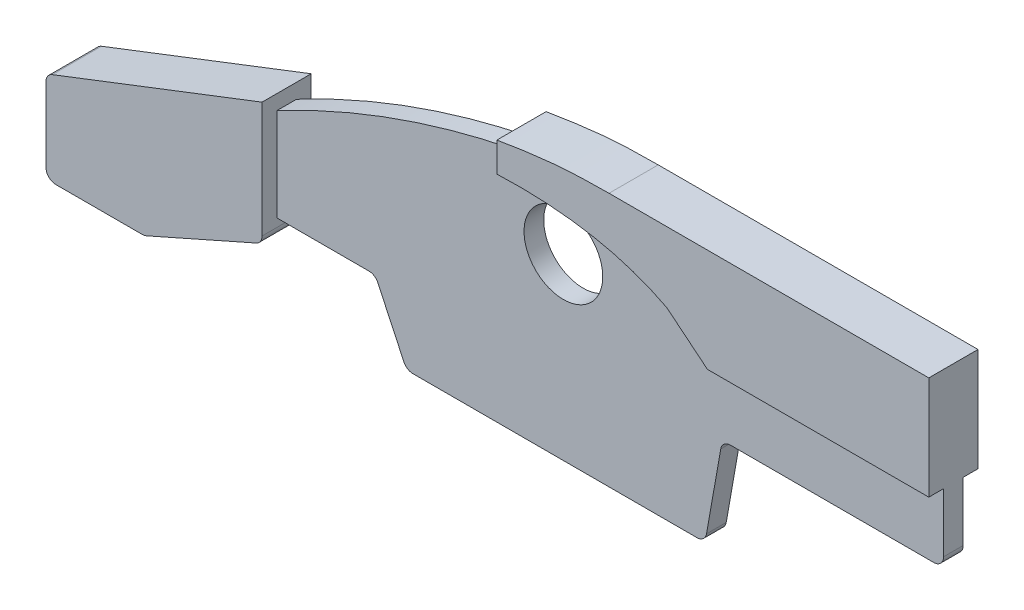
from build123d import *

# Parameters (mm, degrees)
SKETCH_1_R          = 8
EXTRUDE_1_DEPTH     = 10
CUT_EXTRUDE_2_DEPTH = 3
CUT_EXTRUDE_3_DEPTH = 3
FILLET_1_R          = 2


with BuildPart() as part:
    # 草图1 → 凸台-拉伸1 (new body)
    with BuildSketch(Plane.XY):
        with BuildLine():
            Line((-56.424978154, 18.5), (-56.424978154, 0))
            Line((-56.424978154, 0), (-36.424978154, 0))
            Line((-36.424978154, 0), (-12.510711799, 10.595719206))
            Line((-12.510711799, 10.595719206), (-12.510711799, 13.595719206))
            Line((-12.510711799, 13.595719206), (7.489288201, 13.595719206))
            Line((7.489288201, 13.595719206), (13.872204282, 0))
            Line((13.872204282, 0), (74.552459824, 0))
            Line((74.552459824, 0), (78.025423377, 19.69615506))
            Line((78.025423377, 19.69615506), (123.025423377, 19.69615506))
            Line((123.025423377, 19.69615506), (123.025423377, 54.69615506))
            Line((123.025423377, 54.69615506), (58.025423377, 54.69615506))
            add(Edge.make_bspline(
                [(58.025423377, 54.69615506), (48.897941568, 54.692205697), (43.17687282, 53.988854745), (35.233696766, 52.670853795)],
                knots=[0, 0, 0, 0, 1, 1, 1, 1], degree=3))
            Line((35.233696766, 52.670853795), (35.233696766, 49.670853795))
            add(Edge.make_bspline(
                [(35.233696766, 49.670853795), (10.57425282, 44.720207412), (-12.510711799, 32.467844976)],
                knots=[0, 0, 0, 1, 1, 1], degree=2))
            Line((-12.510711799, 32.467844976), (-12.510711799, 35.467844976))
            Line((-12.510711799, 35.467844976), (-56.424978154, 18.5))
        make_face()
        with Locations((45.747275879, 36.3493933)):
            Circle(SKETCH_1_R, mode=Mode.SUBTRACT)
    extrude(amount=EXTRUDE_1_DEPTH)

    # 草图2 → 切除-拉伸2 (cut)
    with BuildSketch(Plane.XY.offset(10)):
        with BuildLine():
            Line((-12.510711799, 32.467844976), (-12.510711799, 13.595719206))
            Line((-12.510711799, 13.595719206), (7.489288201, 13.595719206))
            Line((7.489288201, 13.595719206), (13.872204282, 0))
            Line((13.872204282, 0), (74.552459824, 0))
            Line((74.552459824, 0), (78.025423377, 19.69615506))
            Line((78.025423377, 19.69615506), (123.025423377, 19.69615506))
            Line((123.025423377, 19.69615506), (123.025423377, 33.69615506))
            Line((123.025423377, 33.69615506), (78.025423377, 33.69615506))
            add(Edge.make_bspline(
                [(69.768901699, 40.433897673), (72.258439371, 38.402308014), (75.204387373, 35.998264258), (78.025423377, 33.69615506)],
                knots=[0, 0, 0, 0, 1, 1, 1, 1], degree=3))
            add(Edge.make_bspline(
                [(35.233696766, 46.670853795), (56.25429865, 47.512975461), (69.768901699, 40.433897673)],
                knots=[0, 0, 0, 1, 1, 1], degree=2))
            Line((35.233696766, 46.670853795), (35.233696766, 49.670853795))
            add(Edge.make_bspline(
                [(-12.510711799, 32.467844976), (10.107568712, 45.643152542), (35.233696766, 49.670853795)],
                knots=[0, 0, 0, 1, 1, 1], degree=2))
        make_face()
    extrude(amount=-CUT_EXTRUDE_2_DEPTH, mode=Mode.SUBTRACT)

    # 草图3 → 切除-拉伸3 (cut)
    with BuildSketch(Plane(origin=(0, 0, 0), x_dir=(-1, 0, 0), z_dir=(0, 0, -1))):
        with BuildLine():
            Line((-123.025423377, 19.69615506), (-78.025423377, 19.69615506))
            Line((-78.025423377, 19.69615506), (-74.552459824, 0))
            Line((-74.552459824, 0), (-13.872204282, 0))
            Line((-13.872204282, 0), (-7.489288201, 13.595719206))
            Line((-7.489288201, 13.595719206), (12.510711799, 13.595719206))
            Line((12.510711799, 13.595719206), (12.510711799, 32.467844976))
            add(Edge.make_bspline(
                [(-35.233696766, 49.670853795), (-9.646215757, 44.931714493), (12.510711799, 32.467844976)],
                knots=[0, 0, 0, 1, 1, 1], degree=2))
            Line((-35.233696766, 49.670853795), (-35.233696766, 46.670322435))
            add(Edge.make_bspline(
                [(-35.233696766, 46.670322435), (-53.573988888, 48.036148069), (-69.589003354, 41.428180454)],
                knots=[0, 0, 0, 1, 1, 1], degree=2))
            add(Edge.make_bspline(
                [(-69.589003354, 41.428180454), (-74.339147925, 38.238278194), (-78.025423377, 33.69615506)],
                knots=[0, 0, 0, 1, 1, 1], degree=2))
            Line((-78.025423377, 33.69615506), (-123.025423377, 33.69615506))
            Line((-123.025423377, 33.69615506), (-123.025423377, 19.69615506))
        make_face()
    extrude(amount=-CUT_EXTRUDE_3_DEPTH, mode=Mode.SUBTRACT)

    # 圆角1
    fillet_1_edges = [part.edges().sort_by_distance(p)[0] for p in [
        (-12.510711799, 10.595719206, 5),
        (-36.424978154, 0, 5),
        (-56.424978154, 0, 5),
        (-56.424978154, 18.5, 5),
        (123.025423377, 19.69615506, 5),
        (78.025423377, 19.69615506, 5),
        (74.552459824, 0, 5),
        (13.872204282, 0, 5),
        (7.489288201, 13.595719206, 5),
    ]]
    fillet(fillet_1_edges, radius=FILLET_1_R)


solid = part.part
